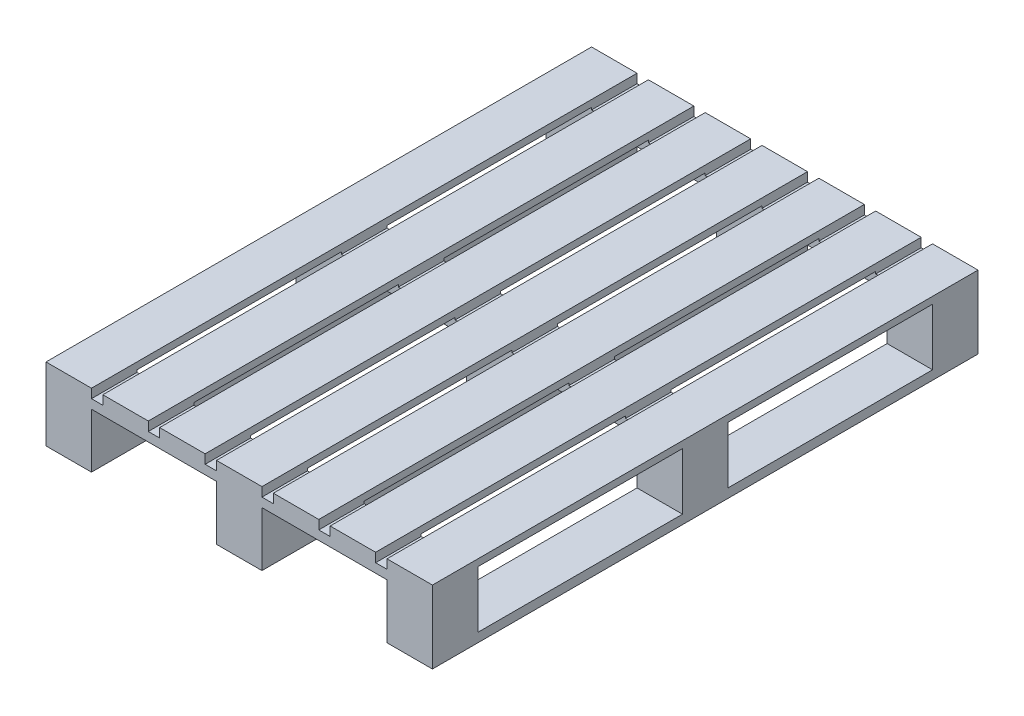
from build123d import *

# Parameters (mm, degrees)
SKETCH1_W           = 850
SKETCH1_H           = 160
BOSS_EXTRUDE1_DEPTH = 1200
SKETCH2_W           = 275
SKETCH2_H           = 120
CUT_EXTRUDE1_DEPTH  = 1480.222768889
SKETCH3_W           = 450
SKETCH3_H           = 125
CUT_EXTRUDE2_DEPTH  = 1480.222768889
SKETCH4_W           = 25
SKETCH4_H           = 20
CUT_EXTRUDE3_DEPTH  = 1480.222768889


with BuildPart() as part:
    # Sketch1 → Boss-Extrude1 (new body)
    with BuildSketch(Plane.XY):
        with Locations((425, 80)):
            Rectangle(SKETCH1_W, SKETCH1_H)
    extrude(amount=-BOSS_EXTRUDE1_DEPTH)

    # Sketch2 → Cut-Extrude1 (cut, through all)
    with BuildSketch(Plane.XY):
        with Locations((237.5, 60)):
            Rectangle(SKETCH2_W, SKETCH2_H)
        with Locations((612.5, 60)):
            Rectangle(SKETCH2_W, SKETCH2_H)
    extrude(amount=-CUT_EXTRUDE1_DEPTH, mode=Mode.SUBTRACT)

    # Sketch3 → Cut-Extrude2 (cut, through all)
    with BuildSketch(Plane.ZY):
        with Locations((-875, 82.5)):
            Rectangle(SKETCH3_W, SKETCH3_H)
        with Locations((-325, 82.5)):
            Rectangle(SKETCH3_W, SKETCH3_H)
    extrude(amount=-CUT_EXTRUDE2_DEPTH, mode=Mode.SUBTRACT)

    # Sketch4 → Cut-Extrude3 (cut, through all)
    with BuildSketch(Plane.XY):
        with Locations((112.5, 150)):
            Rectangle(SKETCH4_W, SKETCH4_H)
        with Locations((237.5, 150)):
            Rectangle(SKETCH4_W, SKETCH4_H)
        with Locations((362.5, 150)):
            Rectangle(SKETCH4_W, SKETCH4_H)
        with Locations((487.5, 150)):
            Rectangle(SKETCH4_W, SKETCH4_H)
        with Locations((612.5, 150)):
            Rectangle(SKETCH4_W, SKETCH4_H)
        with Locations((737.5, 150)):
            Rectangle(SKETCH4_W, SKETCH4_H)
    extrude(amount=-CUT_EXTRUDE3_DEPTH, mode=Mode.SUBTRACT)


solid = part.part
